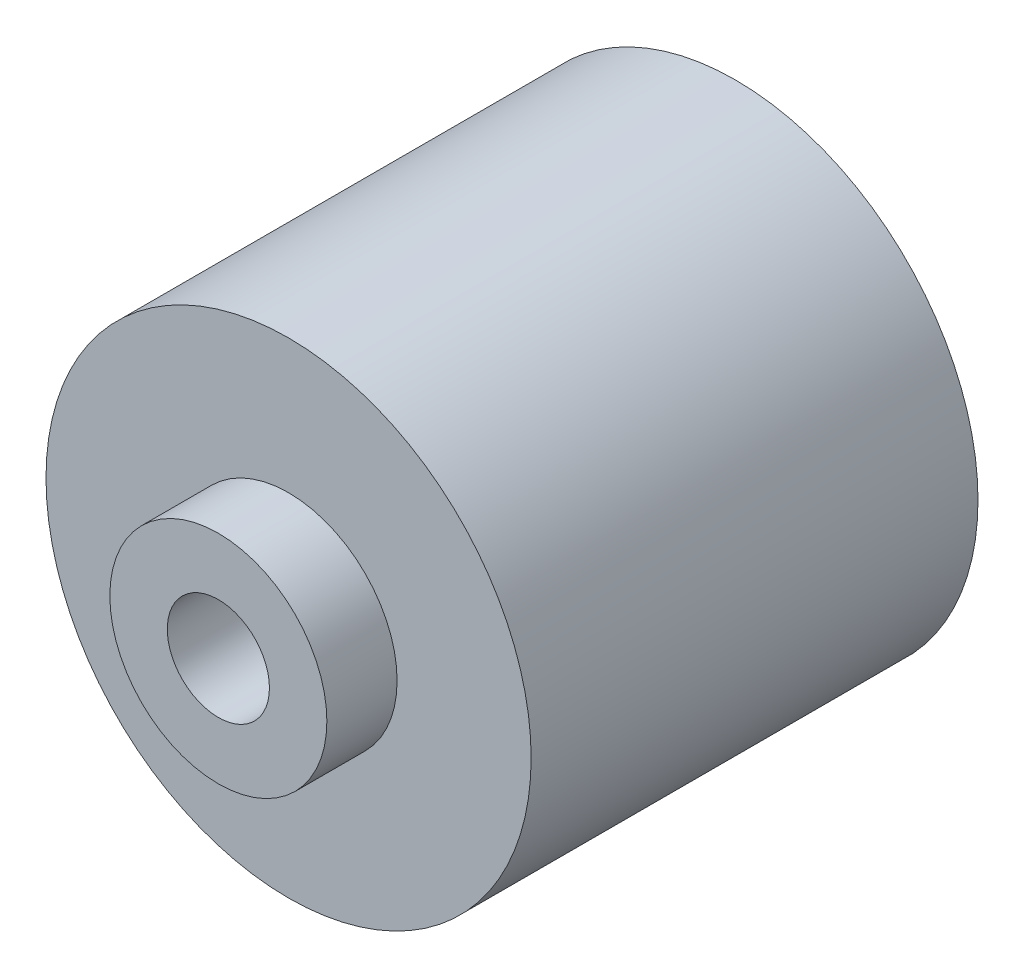
from build123d import *

# Parameters (mm, degrees)
SKETCH1_R           = 19
BOSS_EXTRUDE1_DEPTH = 35
SKETCH5_R           = 8.5
BOSS_EXTRUDE3_DEPTH = 5.5
SKETCH6_R           = 4
CUT_EXTRUDE3_DEPTH  = 10


with BuildPart() as part:
    # Sketch1 → Boss-Extrude1 (new body)
    with BuildSketch(Plane.XY):
        Circle(SKETCH1_R)
    extrude(amount=BOSS_EXTRUDE1_DEPTH)

    # Sketch5 → Boss-Extrude3 (add)
    with BuildSketch(Plane.XY.offset(35)):
        Circle(SKETCH5_R)
    extrude(amount=BOSS_EXTRUDE3_DEPTH)

    # Sketch6 → Cut-Extrude3 (cut)
    with BuildSketch(Plane.XY.offset(40.5)):
        Circle(SKETCH6_R)
    extrude(amount=-CUT_EXTRUDE3_DEPTH, mode=Mode.SUBTRACT)


solid = part.part
